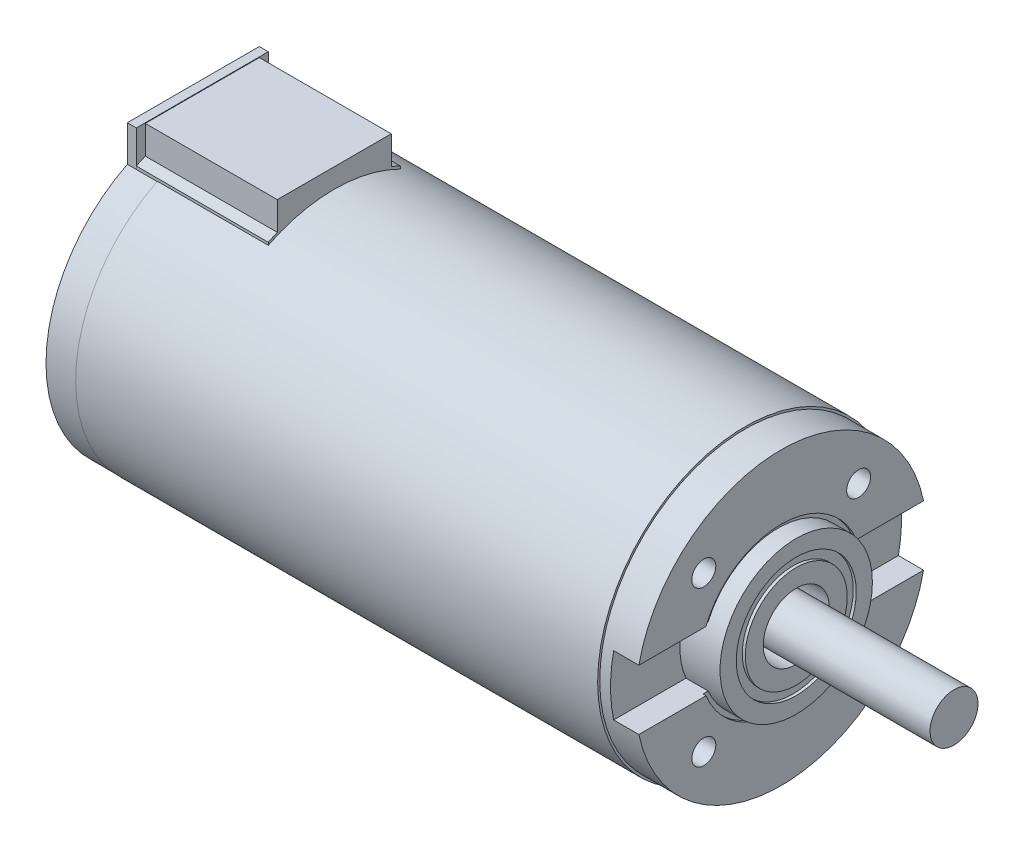
from build123d import *
from build123d.topology import SkipClean

# Parameters (mm, degrees)
SKETCH1_R           = 24.6
BOSS_EXTRUDE1_DEPTH = 87
SKETCH2_R           = 24.25
BOSS_EXTRUDE2_DEPTH = 6
BOSS_EXTRUDE3_DEPTH = 5
CUT_EXTRUDE1_START  = -4.2
SKETCH4_R           = 5.5
SKETCH4_R_2         = 2
CUT_EXTRUDE1_DEPTH  = 4.2
CUT_EXTRUDE2_START  = -0.5
CUT_EXTRUDE2_DEPTH  = 0.5
SKETCH6_R           = 12.7
SKETCH6_R_2         = 5.5
BOSS_EXTRUDE4_DEPTH = 2.5
SKETCH7_R           = 10
SKETCH7_R_2         = 8.5
CUT_EXTRUDE3_DEPTH  = 0.5
SKETCH8_R           = 4
BOSS_EXTRUDE5_DEPTH = 33
CUT_EXTRUDE4_DEPTH  = 3.5
BOSS_EXTRUDE7_START = 22
BOSS_EXTRUDE7_DEPTH = 22


with BuildPart() as part:
    # Sketch1 → Boss-Extrude1 (new body)
    with BuildSketch(Plane(origin=(0, 0, 0), x_dir=(0, 0, -1), z_dir=(1, 0, 0))):
        Circle(SKETCH1_R)
    extrude(amount=-BOSS_EXTRUDE1_DEPTH)

    # Sketch2 → Boss-Extrude2 (add)
    with BuildSketch(Plane(origin=(0, 0, 0), x_dir=(0, 0, -1), z_dir=(1, 0, 0))):
        Circle(SKETCH2_R)
    extrude(amount=BOSS_EXTRUDE2_DEPTH)

    # Sketch3 → Boss-Extrude3 (add)
    with BuildSketch(Plane.ZY.offset(87)):
        with BuildLine():
            Line((11, 27.947721977), (-11, 27.947721977))
            Line((-11, 27.947721977), (-11, 21.947721977))
            ThreePointArc((-11, 21.947721977), (0, -24.55), (11, 21.947721977))
            Line((11, 21.947721977), (11, 27.947721977))
        make_face()
    extrude(amount=BOSS_EXTRUDE3_DEPTH)

    # Sketch4 → Cut-Extrude1 (cut)
    with BuildSketch(Plane(origin=(6, 0, 0), x_dir=(0, 0, -1), z_dir=(1, 0, 0)).offset(CUT_EXTRUDE1_START)):
        Circle(SKETCH4_R)
        with Locations((-12.904698757, 12.904698757)):
            Circle(SKETCH4_R_2)
        with Locations((12.904698757, 12.904698757)):
            Circle(SKETCH4_R_2)
        with Locations((12.904698757, -12.904698757)):
            Circle(SKETCH4_R_2)
        with Locations((-12.904698757, -12.904698757)):
            Circle(SKETCH4_R_2)
        with BuildLine():
            Line((-23.728938029, 5), (-11.674330816, 5))
            ThreePointArc((-11.674330816, 5), (-12.7, 0), (-11.674330816, -5))
            Line((-11.674330816, -5), (-23.728938029, -5))
            ThreePointArc((-23.728938029, -5), (-24.25, 0), (-23.728938029, 5))
        make_face()
        with BuildLine():
            Line((11.674330816, -5), (23.728938029, -5))
            ThreePointArc((23.728938029, -5), (24.25, 0), (23.728938029, 5))
            Line((23.728938029, 5), (11.674330816, 5))
            ThreePointArc((11.674330816, 5), (12.7, 0), (11.674330816, -5))
        make_face()
    extrude(amount=CUT_EXTRUDE1_DEPTH, mode=Mode.SUBTRACT)

    # Sketch5 → Cut-Extrude2 (cut)
    with SkipClean():  # the faces are left unmerged after this step: merging them gives an invalid solid
        with BuildSketch(Plane(origin=(6, 0, 0), x_dir=(0, 0, -1), z_dir=(1, 0, 0)).offset(CUT_EXTRUDE2_START)):
            with BuildLine():
                Line((-11.674330816, 5), (-12.539936204, 5))
                ThreePointArc((-12.539936204, 5), (0, 13.5), (12.539936204, 5))
                Line((12.539936204, 5), (11.674330816, 5))
                ThreePointArc((11.674330816, 5), (0, 12.7), (-11.674330816, 5))
            make_face()
            with BuildLine():
                Line((-11.674330816, -5), (-12.539936204, -5))
                ThreePointArc((-12.539936204, -5), (0, -13.5), (12.539936204, -5))
                Line((12.539936204, -5), (11.674330816, -5))
                ThreePointArc((11.674330816, -5), (0, -12.7), (-11.674330816, -5))
            make_face()
        extrude(amount=CUT_EXTRUDE2_DEPTH, mode=Mode.SUBTRACT)

    # Sketch6 → Boss-Extrude4 (add)
    with BuildSketch(Plane(origin=(6, 0, 0), x_dir=(0, 0, -1), z_dir=(1, 0, 0))):
        Circle(SKETCH6_R)
        Circle(SKETCH6_R_2, mode=Mode.SUBTRACT)
    extrude(amount=BOSS_EXTRUDE4_DEPTH)

    # Sketch7 → Cut-Extrude3 (cut)
    with BuildSketch(Plane(origin=(8.5, 0, 0), x_dir=(0, 0, -1), z_dir=(1, 0, 0))):
        Circle(SKETCH7_R)
        Circle(SKETCH7_R_2, mode=Mode.SUBTRACT)
    extrude(amount=-CUT_EXTRUDE3_DEPTH, mode=Mode.SUBTRACT)

    # Sketch8 → Boss-Extrude5 (add)
    with BuildSketch(Plane(origin=(1.8, 0, 0), x_dir=(0, 0, -1), z_dir=(1, 0, 0))):
        Circle(SKETCH8_R)
    extrude(amount=BOSS_EXTRUDE5_DEPTH)

    # Sketch9 → Cut-Extrude4 (cut)
    with BuildSketch(Plane(origin=(-87, 0, 0), x_dir=(0, 0, -1), z_dir=(1, 0, 0))):
        with BuildLine():
            Line((11, 21.947721977), (11, 27.947721977))
            Line((11, 27.947721977), (-11, 27.947721977))
            Line((-11, 27.947721977), (-11, 21.947721977))
            ThreePointArc((-11, 21.947721977), (0, 24.55), (11, 21.947721977))
        make_face()
    extrude(amount=-CUT_EXTRUDE4_DEPTH, mode=Mode.SUBTRACT)

    # Sketch11 → Boss-Extrude7 (add)
    with BuildSketch(Plane(origin=(-90.5, 0, 0), x_dir=(0, 0, -1), z_dir=(1, 0, 0)).offset(BOSS_EXTRUDE7_START)):
        with BuildLine():
            Line((-9.5, 27.847721977), (-9.5, 23.12466216))
            ThreePointArc((-9.5, 23.12466216), (-10.256840655, 22.799061818), (-11.002541178, 22.448699019))
            Line((-11.002541178, 22.448699019), (-11, 21.947721977))
            ThreePointArc((-11, 21.947721977), (0, 24.55), (11, 21.947721977))
            Line((11, 21.947721977), (11.002541178, 22.448699019))
            ThreePointArc((11.002541178, 22.448699019), (10.256840655, 22.799061818), (9.5, 23.12466216))
            Line((9.5, 23.12466216), (9.5, 27.847721977))
            Line((9.5, 27.847721977), (-9.5, 27.847721977))
        make_face()
    extrude(amount=-BOSS_EXTRUDE7_DEPTH)

    # Sketch12 → Revolve1 (revolve)
    with BuildSketch(Plane.XY, mode=Mode.PRIVATE) as revolve1_sk:
        Polygon((-92, 4), (-97, 4), (-97, 2.5), (-107, 2.5), (-107, 0), (-92, 0), align=None)
    revolve(revolve1_sk.sketch.rotate(Axis((0, 0, 0), (-1, 0, 0)), 90), axis=Axis((0, 0, 0), (-1, 0, 0)))


solid = part.part
